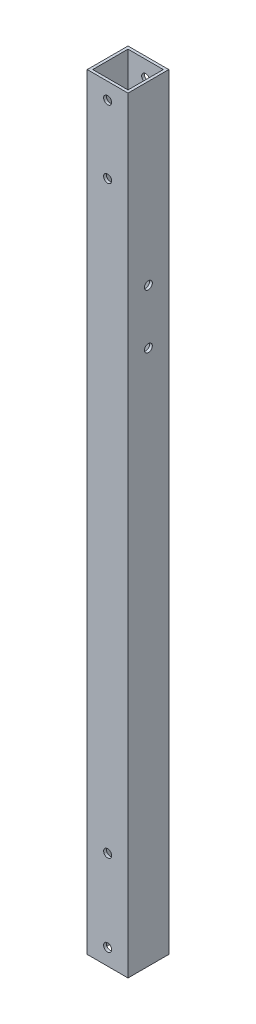
from build123d import *

# Parameters (mm, degrees)
SKETCH_1_W          = 15
SKETCH_1_H          = 15
SKETCH_1_W_2        = 13
SKETCH_1_H_2        = 13
EXTRUDE_1_DEPTH     = 282
SKETCH_2_R          = 1.475
CUT_EXTRUDE_1_DEPTH = 283.498230083
SKETCH_3_R          = 1.45
CUT_EXTRUDE_2_DEPTH = 283.498230083


with BuildPart() as part:
    # 草图1 → 拉伸-薄壁1 (new body)
    with BuildSketch(Plane(origin=(0, 0, 0), x_dir=(1, 0, 0), z_dir=(0, 1, 0))):
        Rectangle(SKETCH_1_W, SKETCH_1_H)
        Rectangle(SKETCH_1_W_2, SKETCH_1_H_2, mode=Mode.SUBTRACT)
    extrude(amount=EXTRUDE_1_DEPTH)

    # 草图2 → 切除-拉伸1 (cut, through all)
    with BuildSketch(Plane.XY.offset(7.5)):
        with Locations((0, 36)):
            Circle(SKETCH_2_R)
        with Locations((0, 6)):
            Circle(SKETCH_2_R)
        with Locations((0, 276)):
            Circle(SKETCH_2_R)
        with Locations((0, 251)):
            Circle(SKETCH_2_R)
    extrude(amount=-CUT_EXTRUDE_1_DEPTH, mode=Mode.SUBTRACT)

    # 草图3 → 切除-拉伸2 (cut, through all)
    with BuildSketch(Plane(origin=(7.5, 0, 0), x_dir=(0, 0, -1), z_dir=(1, 0, 0))):
        with Locations((0, 217)):
            Circle(SKETCH_3_R)
        with Locations((0, 197)):
            Circle(SKETCH_3_R)
    extrude(amount=-CUT_EXTRUDE_2_DEPTH, mode=Mode.SUBTRACT)


solid = part.part
